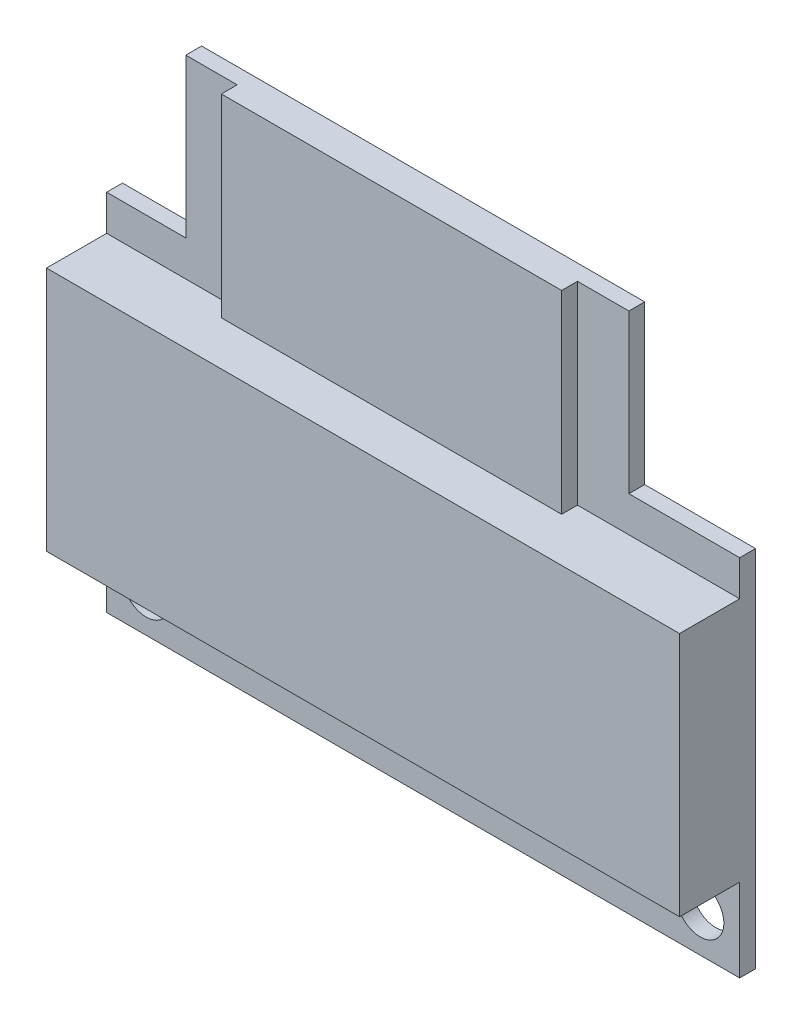
from build123d import *

# Parameters (mm, degrees)
SALIENTE_EXTRUIR1_DEPTH = 1
SALIENTE_EXTRUIR2_DEPTH = 1
CROQUIS3_W              = 40
CROQUIS3_H              = 15.5
SALIENTE_EXTRUIR3_DEPTH = 2.8
CROQUIS4_R              = 1.5
CORTAR_EXTRUIR1_DEPTH   = 1


with BuildPart() as part:
    # Croquis1 → Saliente-Extruir1 (new body)
    with BuildSketch(Plane.XY):
        Polygon((-88.270256069, -7.657514328), (-88.270256069, 15.342485672), (-83.270256069, 15.342485672), (-83.270256069, 25.342485672), (-55.270256069, 25.342485672), (-55.270256069, 15.342485672), (-48.270256069, 15.342485672), (-48.270256069, -7.657514328), align=None)
    extrude(amount=SALIENTE_EXTRUIR1_DEPTH)

    # Croquis2 → Saliente-Extruir2 (add)
    with BuildSketch(Plane.XY.offset(1)):
        Polygon((-88.270256069, -2.407514328), (-88.270256069, 13.092485672), (-80.020256069, 13.092485672), (-80.020256069, 25.342485672), (-58.520256069, 25.342485672), (-58.520256069, 13.092485672), (-48.270256069, 13.092485672), (-48.270256069, -2.407514328), align=None)
    extrude(amount=SALIENTE_EXTRUIR2_DEPTH)

    # Croquis3 → Saliente-Extruir3 (add)
    with BuildSketch(Plane.XY.offset(2)):
        with Locations((-68.270256069, 5.342485672)):
            Rectangle(CROQUIS3_W, CROQUIS3_H)
    extrude(amount=SALIENTE_EXTRUIR3_DEPTH)

    # Croquis4 → Cortar-Extruir1 (cut)
    with BuildSketch(Plane.XY.offset(1)):
        with Locations((-85.770256069, -5.157514328)):
            Circle(CROQUIS4_R)
        with Locations((-50.770256069, -5.157514328)):
            Circle(CROQUIS4_R)
    extrude(amount=-CORTAR_EXTRUIR1_DEPTH, mode=Mode.SUBTRACT)


solid = part.part
